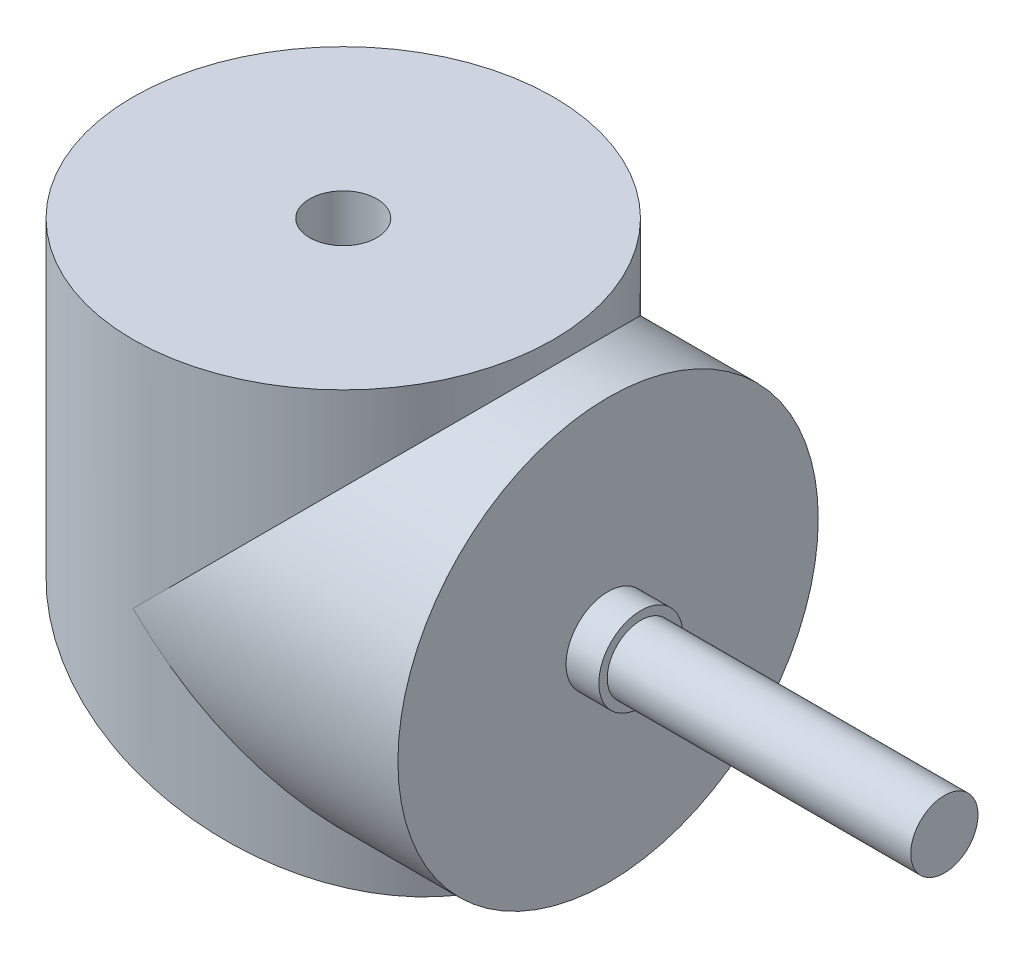
from build123d import *

# Parameters (mm, degrees)
SKETCH1_R                = 37.5
BOSS_EXTRUDE1_DEPTH      = 47.25
BOSS_EXTRUDE2_DEPTH      = 41.55
BOSS_EXTRUDE2_DEPTH_BACK = 39.70459341
SKETCH2_R                = 37.5
CUT_EXTRUDE1_DEPTH       = 74.247627948
CUT_EXTRUDE1_DEPTH_BACK  = 74.247627948
SKETCH4_R                = 6
BOSS_EXTRUDE3_DEPTH      = 60
SKETCH5_R                = 7.5
BOSS_EXTRUDE4_DEPTH      = 5.85
SKETCH6_R                = 6
CUT_EXTRUDE2_DEPTH       = 58.15


with BuildPart() as part:
    # Sketch1 → Boss-Extrude1 (new body)
    with BuildSketch(Plane(origin=(0, 0, 0), x_dir=(0, 0, -1), z_dir=(1, 0, 0))):
        Circle(SKETCH1_R)
    extrude(amount=BOSS_EXTRUDE1_DEPTH)

    # Sketch2 → Boss-Extrude2 (add, two sides: drawn at the far end of the back side and taken through both)
    with BuildSketch(Plane(origin=(0, 0, 0), x_dir=(1, 0, 0), z_dir=(0, 1, 0)).offset(-BOSS_EXTRUDE2_DEPTH_BACK)):
        with Locations(Location((0, 0, 0), (0, 0, 270))):
            Circle(SKETCH2_R)
    extrude(amount=BOSS_EXTRUDE2_DEPTH + BOSS_EXTRUDE2_DEPTH_BACK)

    # Sketch3 → Cut-Extrude1 (cut, two sides: drawn at the far end of the back side and taken through both)
    with BuildSketch(Plane.XY.offset(-CUT_EXTRUDE1_DEPTH_BACK)):
        Polygon((37.5, -39.70459341), (-37.5, -39.70459341), (-37.5, -9.70456466), align=None)
    extrude(amount=CUT_EXTRUDE1_DEPTH + CUT_EXTRUDE1_DEPTH_BACK, mode=Mode.SUBTRACT)

    # Sketch4 → Boss-Extrude3 (add)
    with BuildSketch(Plane(origin=(47.25, 0, 0), x_dir=(0, 0, -1), z_dir=(1, 0, 0))):
        Circle(SKETCH4_R)
    extrude(amount=BOSS_EXTRUDE3_DEPTH)

    # Sketch5 → Boss-Extrude4 (add)
    with BuildSketch(Plane(origin=(47.25, 0, 0), x_dir=(0, 0, -1), z_dir=(1, 0, 0))):
        Circle(SKETCH5_R)
    extrude(amount=BOSS_EXTRUDE4_DEPTH)

    # Sketch6 → Cut-Extrude2 (cut)
    with BuildSketch(Plane(origin=(0, 41.55, 0), x_dir=(1, 0, 0), z_dir=(0, 1, 0))):
        with Locations(Location((0, 0, 0), (0, 0, 270))):
            Circle(SKETCH6_R)
    extrude(amount=-CUT_EXTRUDE2_DEPTH, mode=Mode.SUBTRACT)


solid = part.part
